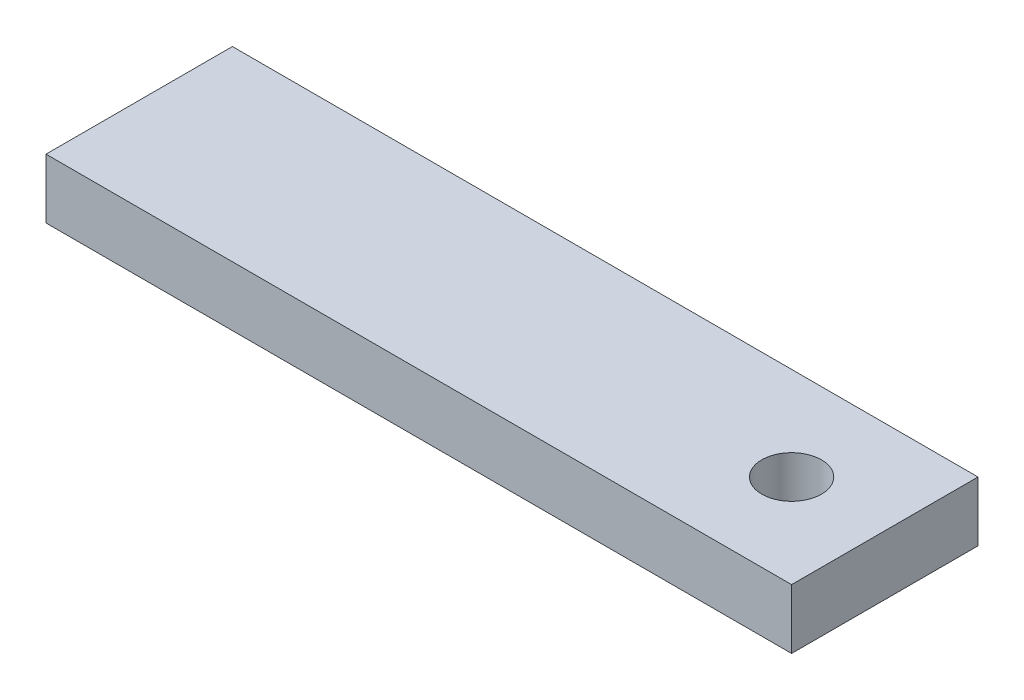
from build123d import *

# Parameters (mm, degrees)
SKETCH1_W           = 100
SKETCH1_H           = 25
SKETCH1_R           = 4
BOSS_EXTRUDE1_DEPTH = 8


with BuildPart() as part:
    # Sketch1 → Boss-Extrude1 (new body)
    with BuildSketch(Plane(origin=(0, 0, 0), x_dir=(1, 0, 0), z_dir=(0, 1, 0))):
        Rectangle(SKETCH1_W, SKETCH1_H)
        with Locations(Location((37.5, 0, 0), (0, 0, 270))):
            Circle(SKETCH1_R, mode=Mode.SUBTRACT)
    extrude(amount=BOSS_EXTRUDE1_DEPTH)


solid = part.part
